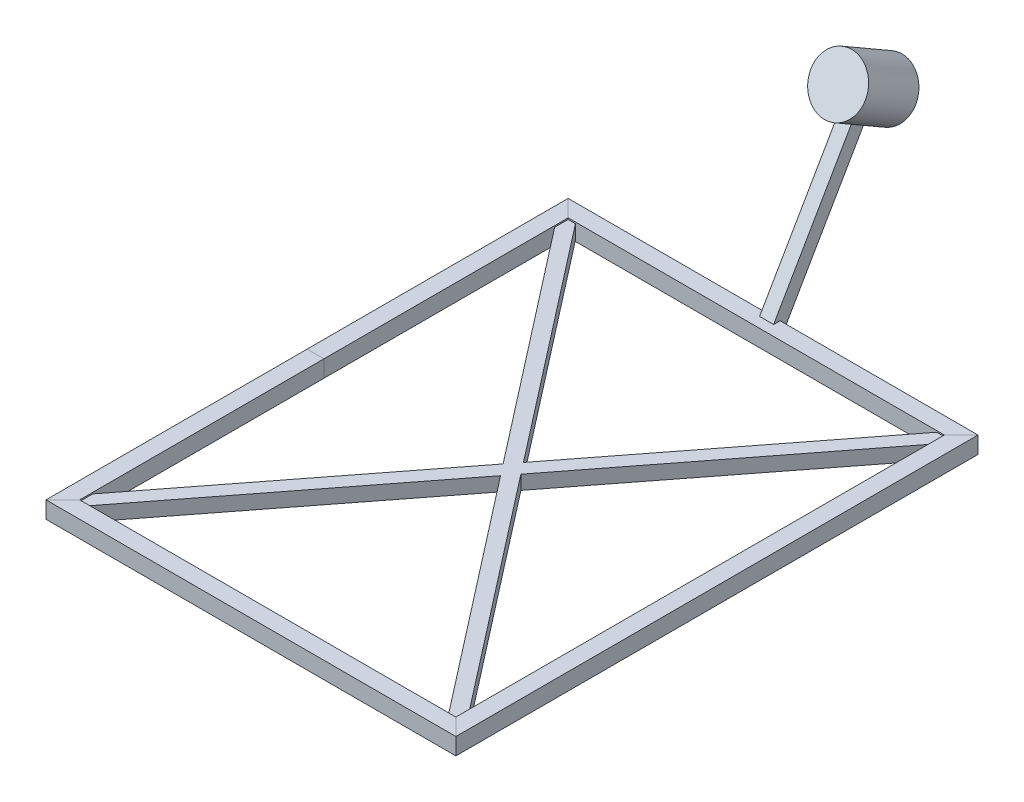
from build123d import *

# Parameters (mm, degrees)
SKETCH1_W                 = 30.48
SKETCH1_H                 = 30.48
SKETCH1_W_2               = 25.4
SKETCH1_H_2               = 25.4
BOSS_EXTRUDE3_DEPTH       = 12.7
BOSS_EXTRUDE3_DEPTH_BACK  = 12.7
BOSS_EXTRUDE13_DEPTH      = 12.7
BOSS_EXTRUDE13_DEPTH_BACK = 12.7
BOSS_EXTRUDE14_DEPTH      = 39.37
BOSS_EXTRUDE14_DEPTH_BACK = 65.786
SKETCH7_R                 = 49.294817714


with BuildPart() as part:
    # Sweep1: sweep along a path in Sketch3
    with BuildLine(Plane(origin=(0, 0, 0), x_dir=(1, 0, 0), z_dir=(0, 1, 0))) as sweep1_path:
        Line((355.6, -457.2), (-355.6, -457.2))
        Line((-355.6, -457.2), (-355.6, 457.2))
        Line((-355.6, 457.2), (355.6, 457.2))
        Line((355.6, 457.2), (355.6, -457.2))
    # Sketch1 → Sweep1 (sweep)
    with BuildSketch(Plane.XY):
        with Locations((-355.6, 0)):
            Rectangle(SKETCH1_W, SKETCH1_H)
        with Locations((-355.6, 0)):
            Rectangle(SKETCH1_W_2, SKETCH1_H_2, mode=Mode.SUBTRACT)
    sweep(path=sweep1_path.line, transition=Transition.RIGHT)


with BuildPart() as body_2:
    # Sketch4 → Boss-Extrude3 (new, two sides: drawn at the far end of the back side and taken through both)
    with BuildSketch(Plane(origin=(0, 0, 0), x_dir=(1, 0, 0), z_dir=(0, 1, 0)).offset(-BOSS_EXTRUDE3_DEPTH_BACK)):
        Polygon((-370.84, 456.861677756), (350.778198584, -472.44), (370.84, -456.861677756), (-350.778198584, 472.44), align=None)
        Polygon((-368.3, -454.337395821), (348.226003109, 469.9), (368.3, 454.337395821), (-348.226003109, -469.9), align=None)
    extrude(amount=BOSS_EXTRUDE3_DEPTH + BOSS_EXTRUDE3_DEPTH_BACK)


with BuildPart() as body_3:
    # Sketch5 → Boss-Extrude13 (new, two sides: drawn at the far end of the back side and taken through both)
    with BuildSketch(Plane(origin=(0, 0, 0), x_dir=(0, 0, -1), z_dir=(1, 0, 0)).offset(-BOSS_EXTRUDE13_DEPTH_BACK)):
        Polygon((624.84, 248.724543073), (472.44, -15.24), (450.442954744, -2.54), (602.842954744, 261.424543073), align=None)
    extrude(amount=BOSS_EXTRUDE13_DEPTH + BOSS_EXTRUDE13_DEPTH_BACK)


with BuildPart() as body_4:
    # Sketch7 → Boss-Extrude14 (new, two sides: drawn at the far end of the back side and taken through both)
    with BuildSketch(Plane(origin=(0, -208.382520882, -360.929113577), x_dir=(-1, 0, 0), z_dir=(0, -0.500000000000001, -0.866025403784438)).offset(-BOSS_EXTRUDE14_DEPTH_BACK)):
        with Locations(Location((0, 572.473478653, 0), (0, 0, 90))):
            Circle(SKETCH7_R)
    extrude(amount=BOSS_EXTRUDE14_DEPTH + BOSS_EXTRUDE14_DEPTH_BACK)


solid = Compound([part.part, body_2.part, body_3.part, body_4.part])
